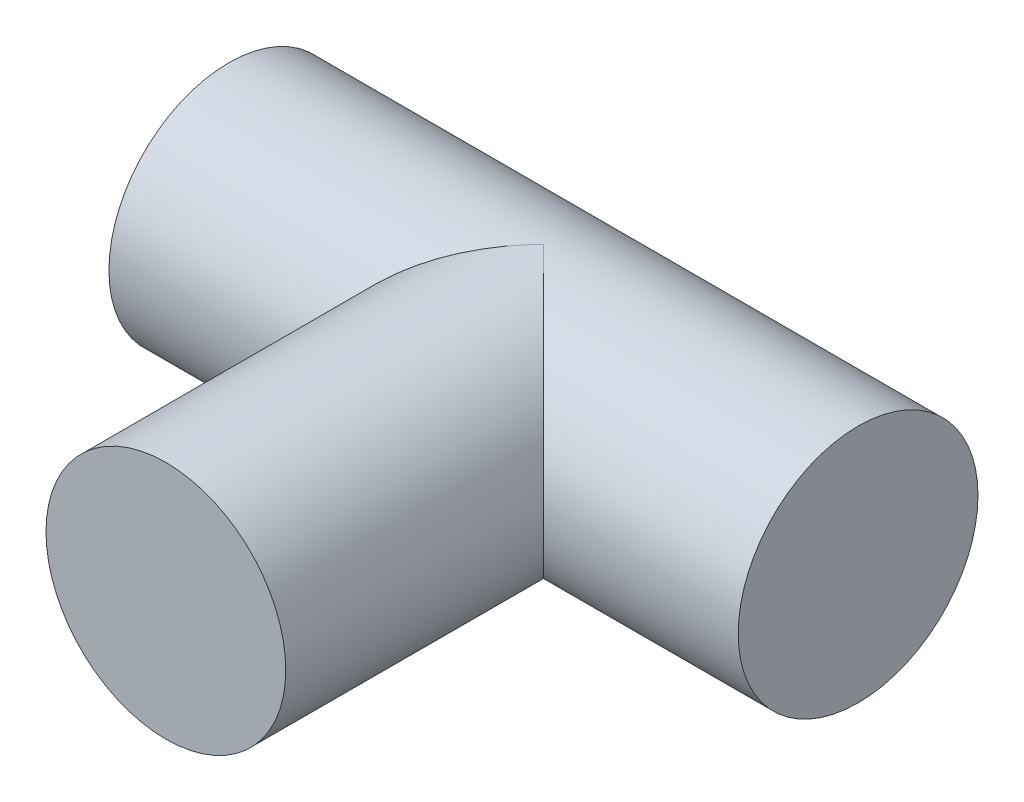
from build123d import *

# Parameters (mm, degrees)
CROQUIS1_R              = 9.525
SALIENTE_EXTRUIR1_DEPTH = 30
CROQUIS2_R              = 9.525
SALIENTE_EXTRUIR2_DEPTH = 25


with BuildPart() as part:
    # Croquis1 → Saliente-Extruir1 (new body)
    with BuildSketch(Plane.XY):
        Circle(CROQUIS1_R)
    extrude(amount=SALIENTE_EXTRUIR1_DEPTH)

    # Croquis2 → Saliente-Extruir2 (add, symmetric)
    with BuildSketch(Plane(origin=(0, 0, 0), x_dir=(0, 0, -1), z_dir=(1, 0, 0))):
        Circle(CROQUIS2_R)
    extrude(amount=SALIENTE_EXTRUIR2_DEPTH, both=True)


solid = part.part
